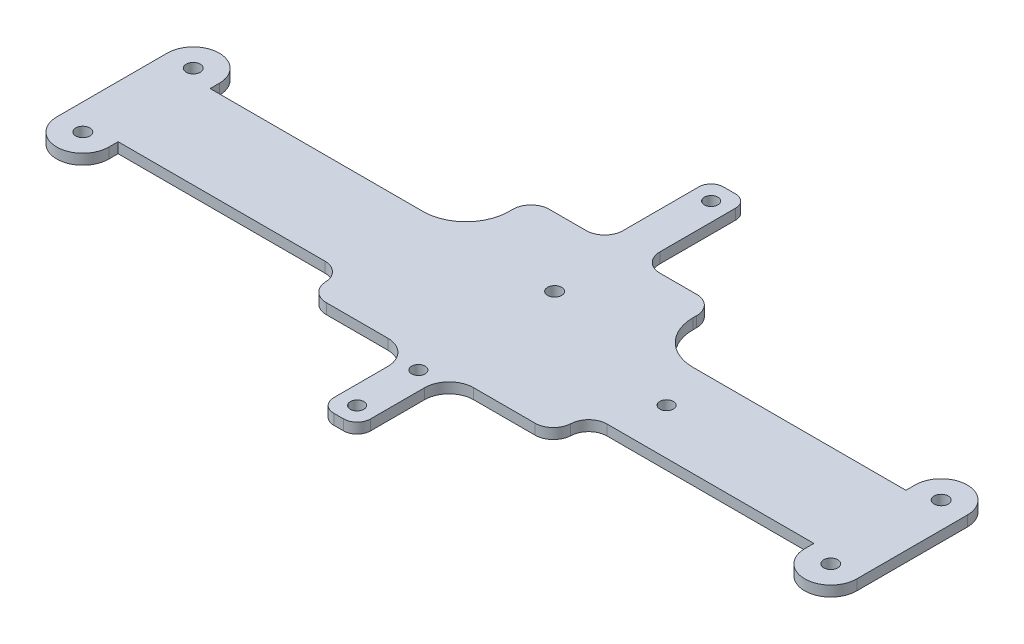
from build123d import *

# Parameters (mm, degrees)
SZKIC1_R                    = 1.15
SZKIC1_R_2                  = 1.150012437
SZKIC1_R_3                  = 1.1
DODANIE_WYCI_GNI_CIE1_DEPTH = 1.7


with BuildPart() as part:
    # Szkic1 → Dodanie-wyciągnięcie1 (new body)
    with BuildSketch(Plane.XZ.offset(-7.087491716)):
        with BuildLine():
            Line((-166.869010382, 45.27), (-166.869010382, 48.27))
            ThreePointArc((-166.869010382, 48.27), (-162.619010382, 52.52), (-158.369010382, 48.27))
            Line((-158.369010382, 48.27), (-158.369010382, 46.77))
            Line((-158.369010382, 46.77), (-124.668997945, 46.77))
            ThreePointArc((-124.668997945, 46.77), (-122.547677602, 47.648679656), (-121.668997945, 49.77))
            Line((-121.668997945, 49.77), (-121.668997945, 49.52))
            ThreePointArc((-121.668997945, 49.52), (-120.790318289, 51.641320344), (-118.668997945, 52.52))
            Line((-118.668997945, 52.52), (-108.668997945, 52.52))
            ThreePointArc((-108.668997945, 52.52), (-105.840570821, 53.691572875), (-104.668997945, 56.52))
            Line((-104.668997945, 56.52), (-104.668997945, 65.32))
            ThreePointArc((-104.668997945, 65.32), (-104.024632864, 66.875634919), (-102.468997945, 67.52))
            Line((-102.468997945, 67.52), (-100.868997945, 67.52))
            ThreePointArc((-100.868997945, 67.52), (-99.313363027, 66.875634919), (-98.668997945, 65.32))
            Line((-98.668997945, 65.32), (-98.668997945, 56.52))
            ThreePointArc((-98.668997945, 56.52), (-97.49742507, 53.691572875), (-94.668997945, 52.52))
            Line((-94.668997945, 52.52), (-84.668997945, 52.52))
            ThreePointArc((-84.668997945, 52.52), (-82.547677602, 51.641320344), (-81.668997945, 49.52))
            Line((-81.668997945, 49.52), (-81.668997945, 49.77))
            ThreePointArc((-81.668997945, 49.77), (-80.790318289, 47.648679656), (-78.668997945, 46.77))
            Line((-78.668997945, 46.77), (-44.968985509, 46.77))
            Line((-44.968985509, 46.77), (-44.968985509, 48.27))
            ThreePointArc((-44.968985509, 48.27), (-40.718985509, 52.52), (-36.468985509, 48.27))
            Line((-36.468985509, 48.27), (-36.468985509, 45.27))
            Line((-36.468985509, 45.27), (-36.468985509, 33.27))
            Line((-36.468985509, 33.27), (-36.468985509, 30.27))
            ThreePointArc((-36.468985509, 30.27), (-40.718985509, 26.02), (-44.968985509, 30.27))
            Line((-44.968985509, 30.27), (-44.968985509, 31.77))
            Line((-44.968985509, 31.77), (-79.668997945, 31.77))
            ThreePointArc((-79.668997945, 31.77), (-84.618745414, 29.719747468), (-86.668997945, 24.77))
            Line((-86.668997945, 24.77), (-86.668997945, 24.17))
            ThreePointArc((-86.668997945, 24.17), (-87.547677602, 22.048679656), (-89.668997945, 21.17))
            Line((-89.668997945, 21.17), (-95.668997945, 21.17))
            ThreePointArc((-95.668997945, 21.17), (-97.790318289, 20.291320344), (-98.668997945, 18.17))
            Line((-98.668997945, 18.17), (-98.668997945, 5.82))
            ThreePointArc((-98.668997945, 5.82), (-99.254784383, 4.405786438), (-100.668997945, 3.82))
            Line((-100.668997945, 3.82), (-102.668997945, 3.82))
            ThreePointArc((-102.668997945, 3.82), (-104.083211508, 4.405786438), (-104.668997945, 5.82))
            Line((-104.668997945, 5.82), (-104.668997945, 18.17))
            ThreePointArc((-104.668997945, 18.17), (-105.547677602, 20.291320344), (-107.668997945, 21.17))
            Line((-107.668997945, 21.17), (-113.668997945, 21.17))
            ThreePointArc((-113.668997945, 21.17), (-115.790318289, 22.048679656), (-116.668997945, 24.17))
            Line((-116.668997945, 24.17), (-116.668997945, 24.77))
            ThreePointArc((-116.668997945, 24.77), (-118.719250477, 29.719747468), (-123.668997945, 31.77))
            Line((-123.668997945, 31.77), (-158.369010382, 31.77))
            Line((-158.369010382, 31.77), (-158.369010382, 30.27))
            ThreePointArc((-158.369010382, 30.27), (-162.619010382, 26.02), (-166.869010382, 30.27))
            Line((-166.869010382, 30.27), (-166.869010382, 33.27))
            Line((-166.869010382, 33.27), (-166.869010382, 45.27))
        make_face()
        with Locations((-162.618997945, 30.27)):
            Circle(SZKIC1_R, mode=Mode.SUBTRACT)
        with Locations((-162.618997945, 48.27)):
            Circle(SZKIC1_R, mode=Mode.SUBTRACT)
        with Locations((-40.718985509, 48.27)):
            Circle(SZKIC1_R_2, mode=Mode.SUBTRACT)
        with Locations((-40.718985509, 30.27)):
            Circle(SZKIC1_R_2, mode=Mode.SUBTRACT)
        with Locations((-101.668997945, 6.82)):
            Circle(SZKIC1_R_3, mode=Mode.SUBTRACT)
        with Locations((-76.468985509, 39.27)):
            Circle(SZKIC1_R_3, mode=Mode.SUBTRACT)
        with Locations((-101.668997945, 54.52)):
            Circle(SZKIC1_R_3, mode=Mode.SUBTRACT)
        with Locations((-101.668997945, 64.52)):
            Circle(SZKIC1_R_3, mode=Mode.SUBTRACT)
        with Locations((-101.668997945, 32.32)):
            Circle(SZKIC1_R, mode=Mode.SUBTRACT)
    extrude(amount=DODANIE_WYCI_GNI_CIE1_DEPTH)


solid = part.part
